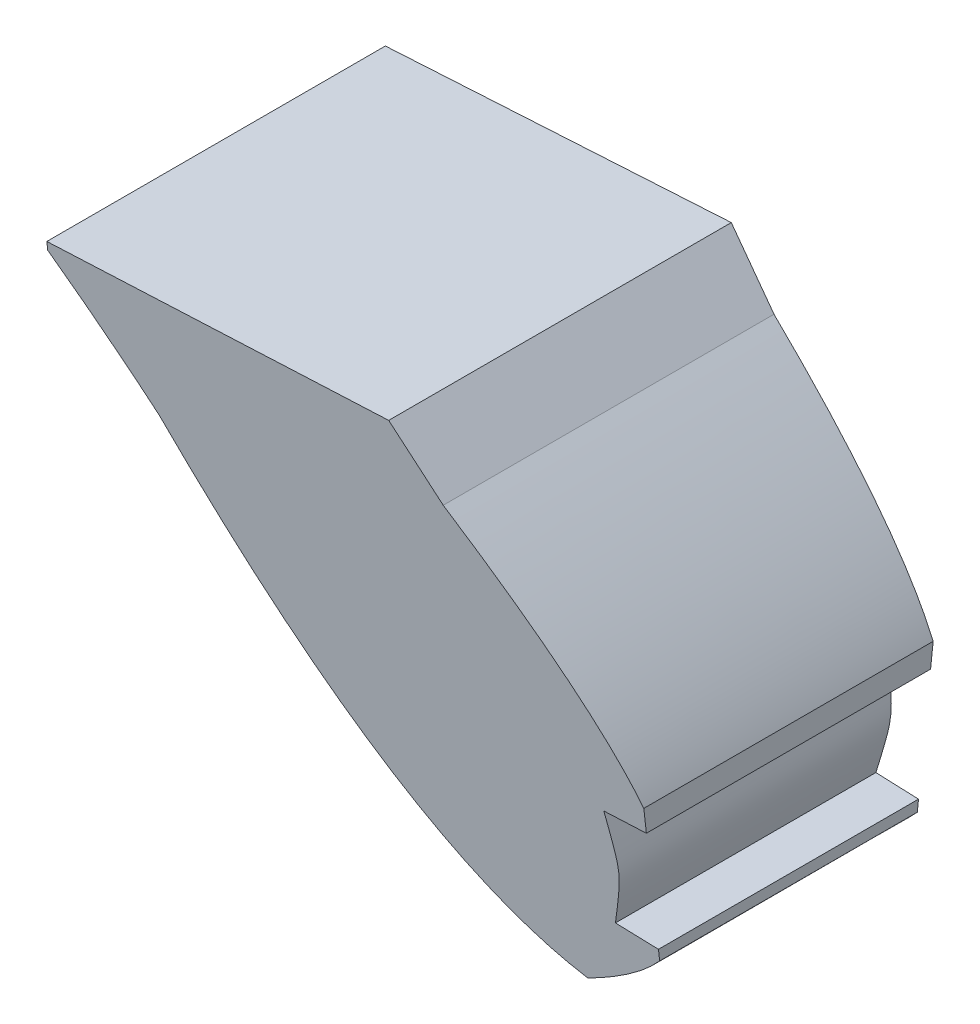
from build123d import *

# Parameters (mm, degrees)
SALIENTE_EXTRUIR1_DEPTH      = 7
SALIENTE_EXTRUIR2_DEPTH      = 7
SALIENTE_EXTRUIR2_DEPTH_BACK = 7
CORTAR_EXTRUIR2_DEPTH        = 28.177550449
CORTAR_EXTRUIR2_DEPTH_BACK   = 28.177550449


with BuildPart() as part:
    # Croquis1 → Saliente-Extruir1 (new, symmetric)
    with BuildSketch(Plane.XY):
        with BuildLine():
            add(Edge.make_bspline(
                [(-18.945192114, 7.540918896), (-10.215008384, -3.697644103), (-2.846604825, -5.059081104)],
                knots=[0.497667241, 0.497667241, 0.497667241, 0.49955428, 0.49955428, 0.49955428], degree=2, weights=[1, 1, 1]))
            add(Edge.make_bspline(
                [(-2.846604825, -5.059081104), (-0.742366882, -3.9352066), (0.355125, -2.723253227)],
                knots=[0.498812075, 0.498812075, 0.498812075, 0.499412845, 0.499412845, 0.499412845], degree=2, weights=[1, 1, 1]))
            Line((0.355125, -2.723253227), (0.355125, -2.284841781))
            Line((0.355125, -2.284841781), (-1.394875, -2.223730435))
            add(Edge.make_bspline(
                [(-1.394875, -2.223730435), (-0.90753067, -0.123730435), (-1.394875, 1.976269565)],
                knots=[0, 0, 0, 1, 1, 1], degree=2, weights=[1, 3.231801219, 1]))
            Line((-1.394875, 1.976269565), (0.355125, 2.284841781))
            Line((0.355125, 2.284841781), (0.355125, 3.001549529))
            add(Edge.make_bspline(
                [(0.355125, 3.001549529), (-1.44872627, 6.058427314), (-6.994875026, 10.477389992)],
                knots=[0.500820705, 0.500820705, 0.500820705, 0.502013312, 0.502013312, 0.502013312], degree=2, weights=[1, 1, 1]))
            Line((-6.994875026, 10.477389992), (-8.981845695, 12.608155172))
            Line((-8.981845695, 12.608155172), (-23.035921146, 11.871612288))
            Line((-23.035921146, 11.871612288), (-23.035921146, 11.54013782))
            ThreePointArc((-23.035921146, 11.54013782), (-20.949684518, 9.582335705), (-18.945192114, 7.540918896))
        make_face()
    extrude(amount=SALIENTE_EXTRUIR1_DEPTH, both=True)

    # Croquis4 → Saliente-Extruir2 (add, two sides: drawn at the far end of the back side and taken through both)
    with BuildSketch(Plane.XY.offset(-SALIENTE_EXTRUIR2_DEPTH_BACK)):
        Polygon((-1.394875, 1.976269565), (0.355125, 2.284841781), (0.355125, 2.067983179), align=None)
    extrude(amount=SALIENTE_EXTRUIR2_DEPTH + SALIENTE_EXTRUIR2_DEPTH_BACK)

    # Croquis6 → Cortar-Extruir2 (cut, two sides: drawn at the far end of the back side and taken through both)
    with BuildSketch(Plane(origin=(0, 0, 0), x_dir=(0, 0, -1), z_dir=(1, 0, 0)).offset(-CORTAR_EXTRUIR2_DEPTH_BACK)):
        Polygon((7, 12.608155172), (7, -5.059081104), (5, -5.059081104), align=None)
        Polygon((-7, 12.608155172), (-7, -5.059081104), (-5, -5.059081104), align=None)
    extrude(amount=CORTAR_EXTRUIR2_DEPTH + CORTAR_EXTRUIR2_DEPTH_BACK, mode=Mode.SUBTRACT)


solid = part.part
